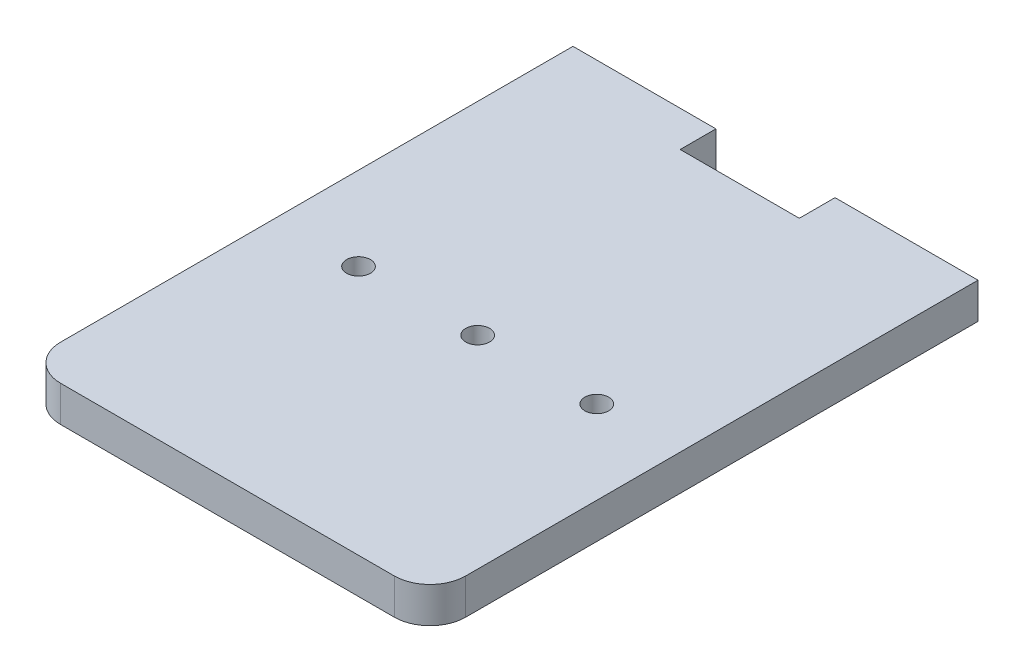
from build123d import *

# Parameters (mm, degrees)
ESQUISSE1_R        = 1
BOSS_EXTRU_1_DEPTH = 3


with BuildPart() as part:
    # Esquisse1 → Boss.-Extru.1 (new body)
    with BuildSketch(Plane(origin=(0, 0, 0), x_dir=(1, 0, 0), z_dir=(0, 1, 0))):
        with BuildLine():
            Line((-5, 46), (-5, 43))
            Line((-5, 43), (5, 43))
            Line((5, 43), (5, 46))
            Line((5, 46), (17, 46))
            Line((17, 46), (17, 3))
            ThreePointArc((17, 3), (16.121320344, 0.878679656), (14, 0))
            Line((14, 0), (-14, 0))
            ThreePointArc((-14, 0), (-16.121320344, 0.878679656), (-17, 3))
            Line((-17, 3), (-17, 46))
            Line((-17, 46), (-5, 46))
        make_face()
        with Locations(Location((0, 21, 0), (0, 0, 270))):
            Circle(ESQUISSE1_R, mode=Mode.SUBTRACT)
        with Locations(Location((-10, 21, 0), (0, 0, 270))):
            Circle(ESQUISSE1_R, mode=Mode.SUBTRACT)
        with Locations(Location((10, 21, 0), (0, 0, 270))):
            Circle(ESQUISSE1_R, mode=Mode.SUBTRACT)
    extrude(amount=BOSS_EXTRU_1_DEPTH)


solid = part.part
